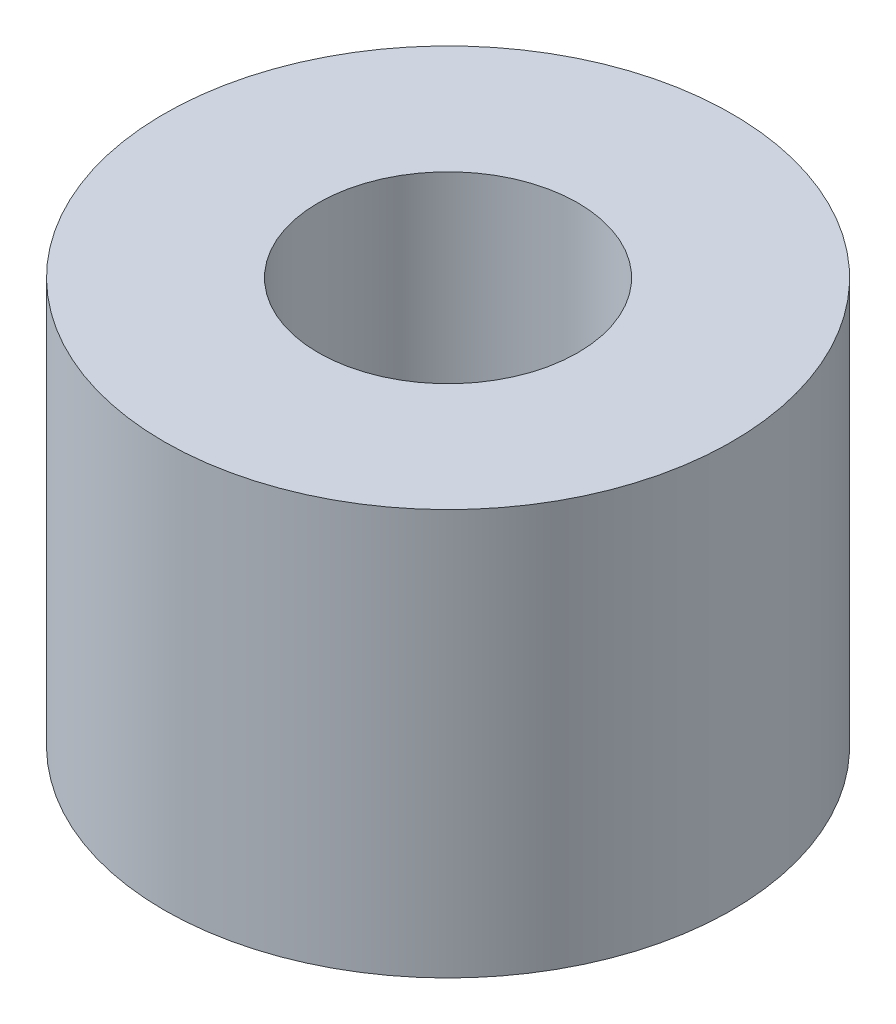
from build123d import *

# Parameters (mm, degrees)
ESBO_O1_R                = 3.5
ESBO_O1_R_2              = 1.6
RESSALTO_EXTRUS_O1_DEPTH = 2.5


with BuildPart() as part:
    # Esboço1 → Ressalto-extrusão1 (new, symmetric)
    with BuildSketch(Plane(origin=(0, 0, 0), x_dir=(1, 0, 0), z_dir=(0, 1, 0))):
        with Locations(Location((0, 0, 0), (0, 0, 270))):
            Circle(ESBO_O1_R)
        with Locations(Location((0, 0, 0), (0, 0, 270))):
            Circle(ESBO_O1_R_2, mode=Mode.SUBTRACT)
    extrude(amount=RESSALTO_EXTRUS_O1_DEPTH, both=True)


solid = part.part
